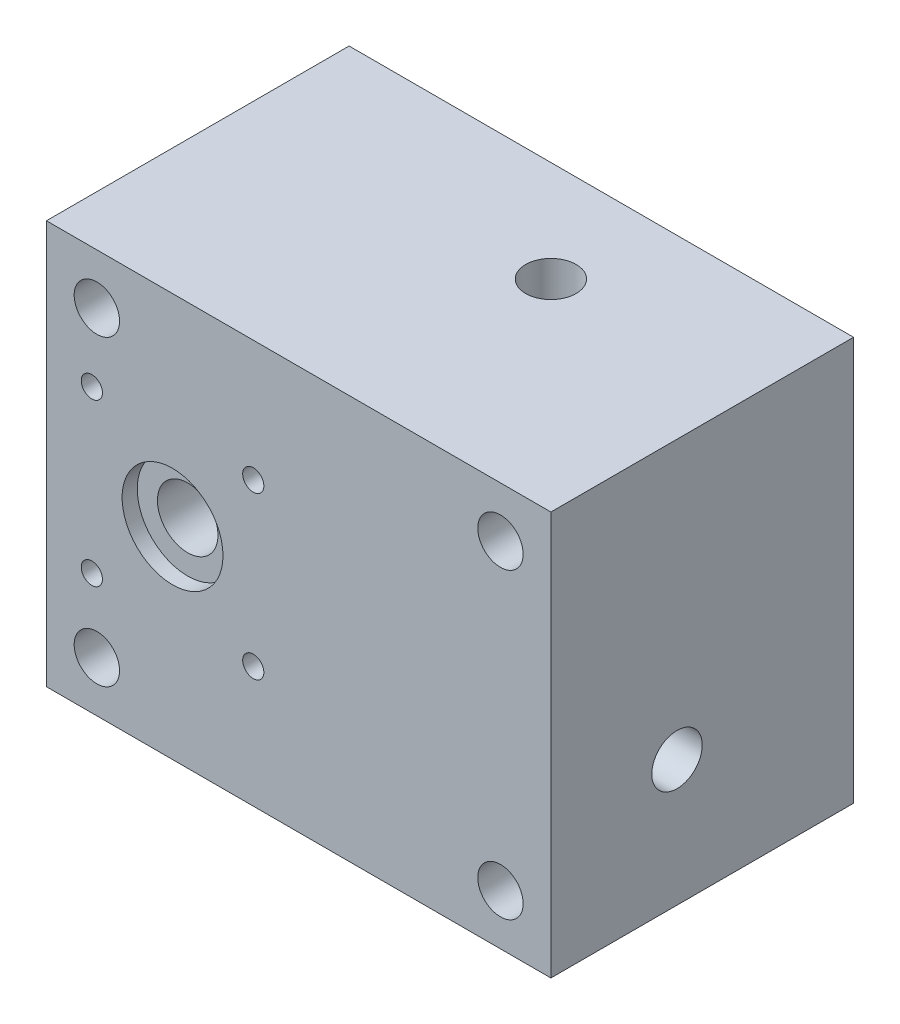
from build123d import *

# Parameters (mm, degrees)
SKETCH_1_W          = 100
SKETCH_1_H          = 80
EXTRUDE_1_DEPTH     = 60
SKETCH_2_R          = 10
CUT_EXTRUDE_1_DEPTH = 3
SKETCH_3_R          = 6
CUT_EXTRUDE_2_DEPTH = 40
SKETCH_4_R          = 8
CUT_EXTRUDE_3_DEPTH = 8
SKETCH_5_R          = 5
CUT_EXTRUDE_4_DEPTH = 70
SKETCH_6_R          = 5
CUT_EXTRUDE_5_DEPTH = 40
SKETCH_7_R          = 7
CUT_EXTRUDE_6_DEPTH = 45
SKETCH_8_R          = 5
CUT_EXTRUDE_7_DEPTH = 30
SKETCH_9_R          = 4.5
CUT_EXTRUDE_8_DEPTH = 101
SKETCH_10_R         = 2.1
CUT_EXTRUDE_9_DEPTH = 10


with BuildPart() as part:
    # 草图1 → 凸台-拉伸1 (new body)
    with BuildSketch(Plane.XY):
        Rectangle(SKETCH_1_W, SKETCH_1_H)
    extrude(amount=EXTRUDE_1_DEPTH)

    # 草图2 → 切除-拉伸1 (cut)
    with BuildSketch(Plane.XY.offset(60)):
        with Locations((-25, 0)):
            Circle(SKETCH_2_R)
    extrude(amount=-CUT_EXTRUDE_1_DEPTH, mode=Mode.SUBTRACT)

    # 草图3 → 切除-拉伸2 (cut)
    with BuildSketch(Plane.XY.offset(60)):
        with Locations((-25, 0)):
            Circle(SKETCH_3_R)
    extrude(amount=-CUT_EXTRUDE_2_DEPTH, mode=Mode.SUBTRACT)

    # 草图4 → 切除-拉伸3 (cut)
    with BuildSketch(Plane(origin=(-50, 0, 0), x_dir=(0, 0, -1), z_dir=(1, 0, 0))):
        with Locations((-20, 0)):
            Circle(SKETCH_4_R)
    extrude(amount=CUT_EXTRUDE_3_DEPTH, mode=Mode.SUBTRACT)

    # 草图5 → 切除-拉伸4 (cut)
    with BuildSketch(Plane(origin=(-50, 0, 0), x_dir=(0, 0, -1), z_dir=(1, 0, 0))):
        with Locations((-20, 0)):
            Circle(SKETCH_5_R)
    extrude(amount=CUT_EXTRUDE_4_DEPTH, mode=Mode.SUBTRACT)

    # 草图6 → 切除-拉伸5 (cut)
    with BuildSketch(Plane(origin=(0, 40, 0), x_dir=(1, 0, 0), z_dir=(0, 1, 0))):
        with Locations(Location((10, -20, 0), (0, 0, 270))):
            Circle(SKETCH_6_R)
    extrude(amount=-CUT_EXTRUDE_5_DEPTH, mode=Mode.SUBTRACT)

    # 草图7 → 切除-拉伸6 (cut)
    with BuildSketch(Plane.XY):
        with Locations(Location((25, -15, 0), (0, 0, 180))):
            Circle(SKETCH_7_R)
    extrude(amount=CUT_EXTRUDE_6_DEPTH, mode=Mode.SUBTRACT)

    # 草图8 → 切除-拉伸7 (cut)
    with BuildSketch(Plane(origin=(50, 0, 0), x_dir=(0, 0, -1), z_dir=(1, 0, 0))):
        with Locations((-35, -15)):
            Circle(SKETCH_8_R)
    extrude(amount=-CUT_EXTRUDE_7_DEPTH, mode=Mode.SUBTRACT)

    # 草图9 → 切除-拉伸8 (cut, symmetric)
    with BuildSketch(Plane.XY):
        with Locations((40, 30)):
            Circle(SKETCH_9_R)
        with Locations((40, -30)):
            Circle(SKETCH_9_R)
        with Locations((-40, 30)):
            Circle(SKETCH_9_R)
        with Locations((-40, -30)):
            Circle(SKETCH_9_R)
    extrude(amount=CUT_EXTRUDE_8_DEPTH, both=True, mode=Mode.SUBTRACT)

    # 草图10 → 切除-拉伸9 (cut)
    with BuildSketch(Plane.XY.offset(60)):
        with Locations((-9, 16)):
            Circle(SKETCH_10_R)
        with Locations((-9, -16)):
            Circle(SKETCH_10_R)
        with Locations((-41, 16)):
            Circle(SKETCH_10_R)
        with Locations((-41, -16)):
            Circle(SKETCH_10_R)
    extrude(amount=-CUT_EXTRUDE_9_DEPTH, mode=Mode.SUBTRACT)


solid = part.part
